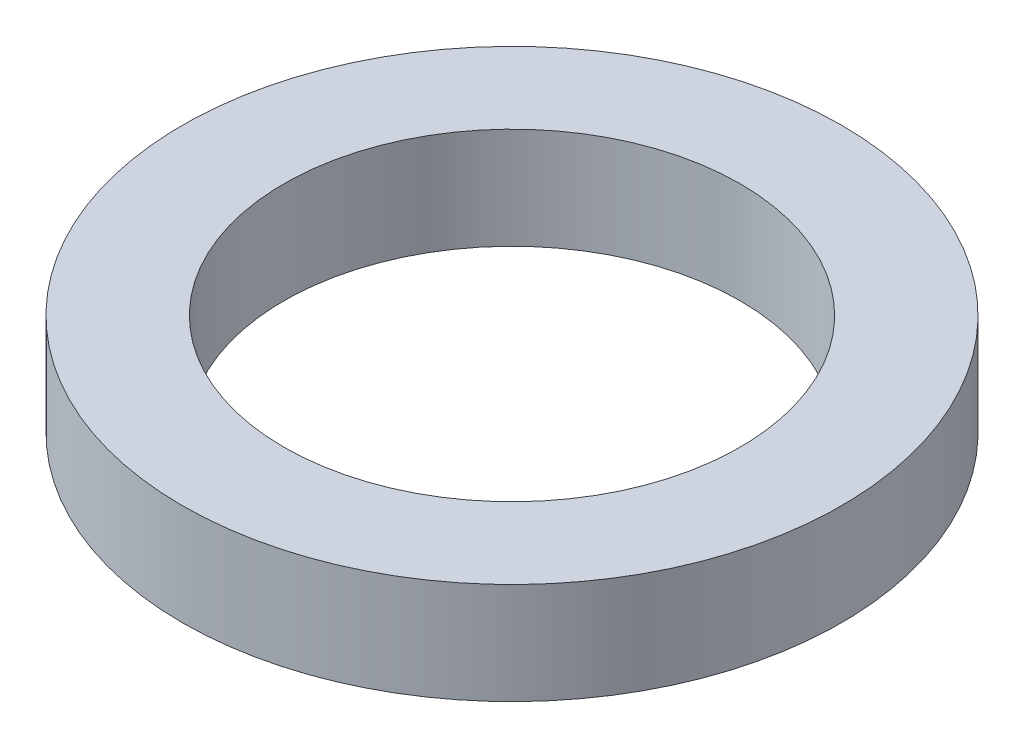
from build123d import *

# Parameters (mm, degrees)
SKETCH1_R           = 3.25
SKETCH1_R_2         = 2.25
BOSS_EXTRUDE1_DEPTH = 1


with BuildPart() as part:
    # Sketch1 → Boss-Extrude1 (new body)
    with BuildSketch(Plane(origin=(0, 0, 0), x_dir=(1, 0, 0), z_dir=(0, 1, 0))):
        with Locations(Location((0, 0, 0), (0, 0, 270))):
            Circle(SKETCH1_R)
        with Locations(Location((0, 0, 0), (0, 0, 270))):
            Circle(SKETCH1_R_2, mode=Mode.SUBTRACT)
    extrude(amount=BOSS_EXTRUDE1_DEPTH)


solid = part.part
